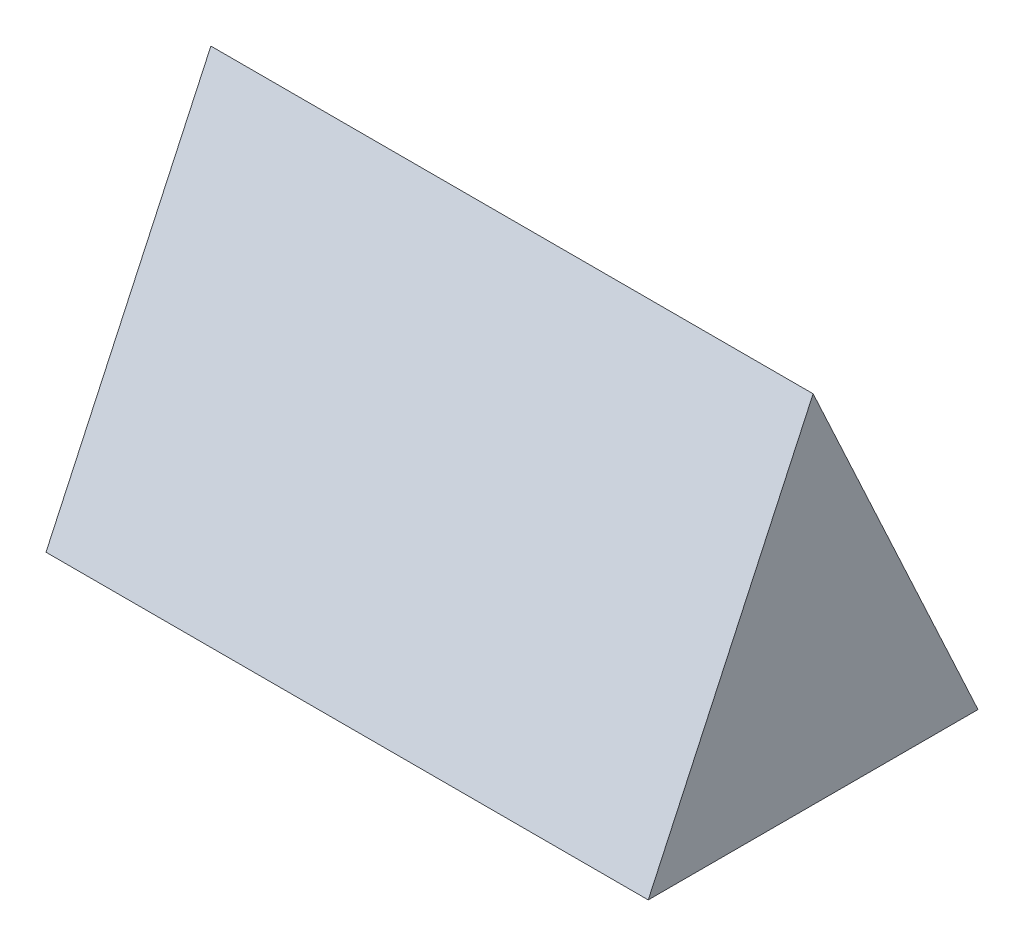
from build123d import *

# Parameters (mm, degrees)
BOSS_EXTRUDE2_DEPTH      = 126.95
BOSS_EXTRUDE2_DEPTH_BACK = 147


with BuildPart() as part:
    # Sketch2 → Boss-Extrude2 (new, two sides: drawn at the far end of the back side and taken through both)
    with BuildSketch(Plane(origin=(0, 0, 0), x_dir=(0, 0, -1), z_dir=(1, 0, 0)).offset(-BOSS_EXTRUDE2_DEPTH_BACK)):
        Polygon((0, -31.021485944), (-75, -31.021485944), (0, 130.878514056), (75, -31.021485944), align=None)
    extrude(amount=BOSS_EXTRUDE2_DEPTH + BOSS_EXTRUDE2_DEPTH_BACK)


solid = part.part
